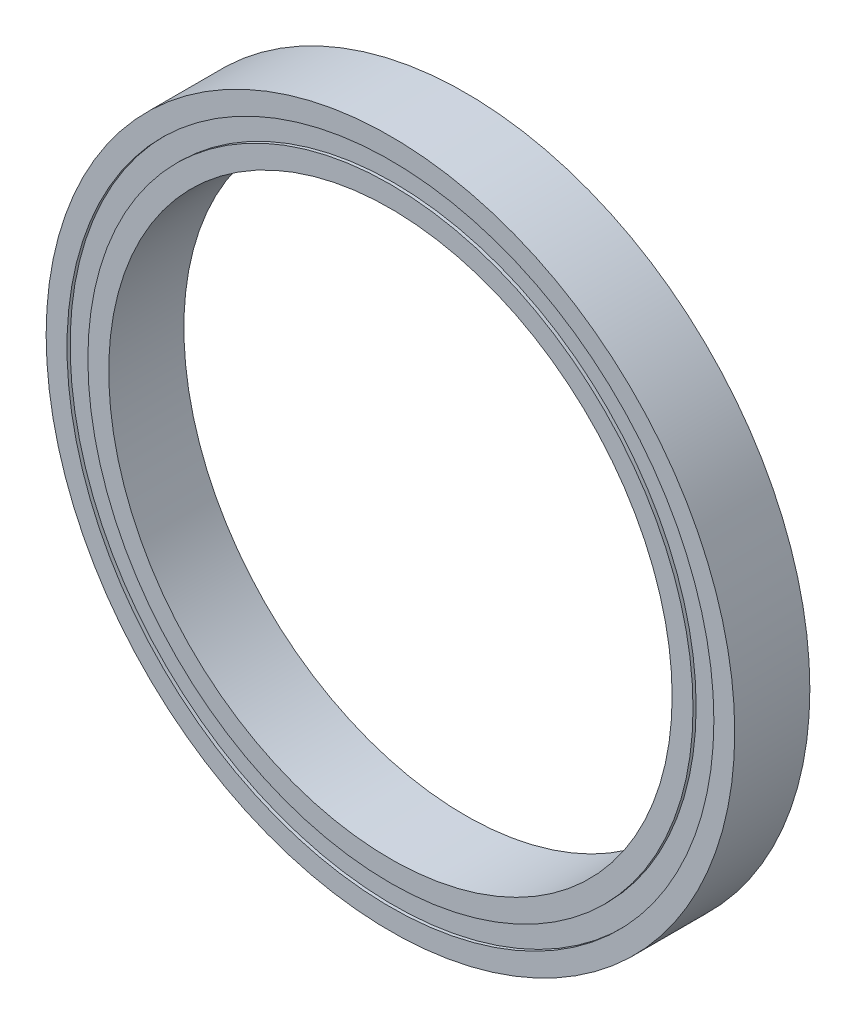
from build123d import *

# Parameters (mm, degrees)
BOSS_EXTRUDE1_DEPTH        = 3
BOSS_EXTRUDE1_DEPTH_BACK   = 3
SKETCH1_R                  = 27.5
SKETCH1_R_2                = 25.833333333
BOSS_EXTRUDE1_2_DEPTH      = 3
BOSS_EXTRUDE1_2_DEPTH_BACK = 3
SKETCH1_R_3                = 24.166666667
SKETCH1_R_4                = 22.5
BOSS_EXTRUDE2_DEPTH        = 2.75
BOSS_EXTRUDE2_DEPTH_BACK   = 2.75
SKETCH1_4_R                = 25.833333333
SKETCH1_4_R_2              = 24.166666667


with BuildPart() as part:
    # Sketch1 → Boss-Extrude1 (new, two sides: drawn at the far end of the back side and taken through both)
    with BuildSketch(Plane.XY.offset(-BOSS_EXTRUDE1_DEPTH_BACK)):
        Circle(SKETCH1_R)
        Circle(SKETCH1_R_2, mode=Mode.SUBTRACT)
    extrude(amount=BOSS_EXTRUDE1_DEPTH + BOSS_EXTRUDE1_DEPTH_BACK)



with BuildPart() as body_2:
    # Sketch1 → Boss-Extrude1 2 (new, two sides: drawn at the far end of the back side and taken through both)
    with BuildSketch(Plane.XY.offset(-BOSS_EXTRUDE1_2_DEPTH_BACK)):
        Circle(SKETCH1_R_3)
        Circle(SKETCH1_R_4, mode=Mode.SUBTRACT)
    extrude(amount=BOSS_EXTRUDE1_2_DEPTH + BOSS_EXTRUDE1_2_DEPTH_BACK)


with BuildPart() as part_1:
    add(part.part)

    add(body_2.part)  # Boss-Extrude2 merges body 2
    # Sketch1<4> → Boss-Extrude2 (add, two sides: drawn at the far end of the back side and taken through both)
    with BuildSketch(Plane.XY.offset(-BOSS_EXTRUDE2_DEPTH_BACK)):
        Circle(SKETCH1_4_R)
        Circle(SKETCH1_4_R_2, mode=Mode.SUBTRACT)
    extrude(amount=BOSS_EXTRUDE2_DEPTH + BOSS_EXTRUDE2_DEPTH_BACK)


solid = part_1.part
